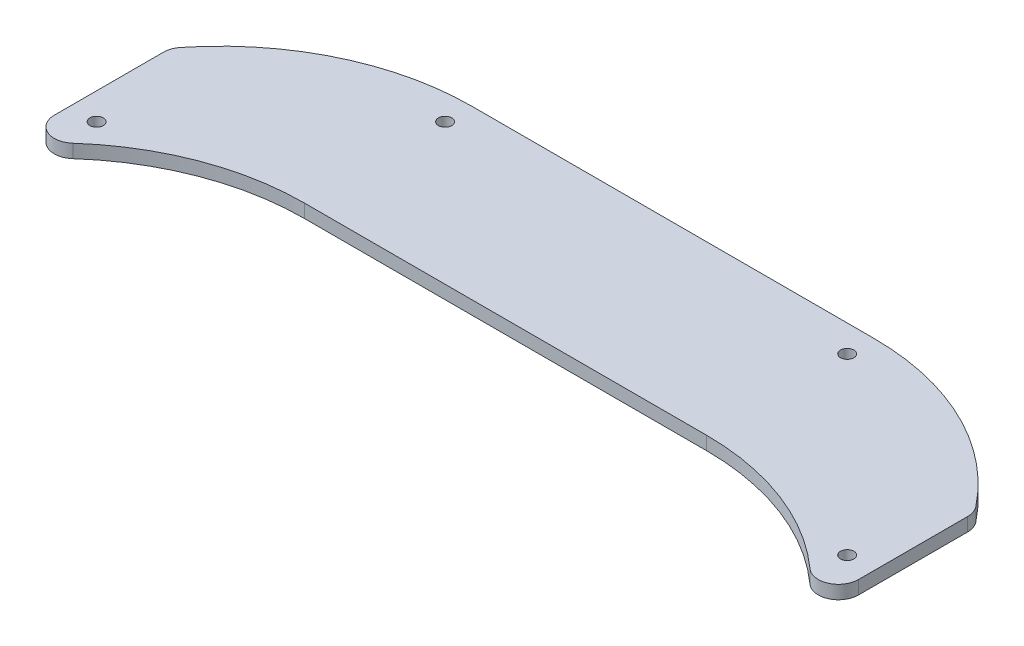
from build123d import *

# Parameters (mm, degrees)
BOSS_EXTRUDE1_DEPTH = 2
SKETCH2_R           = 1
CUT_EXTRUDE1_DEPTH  = 3
FILLET2_R           = 3


with BuildPart() as part:
    # Sketch1 → Boss-Extrude1 (new body)
    with BuildSketch(Plane(origin=(0, 0, 0), x_dir=(1, 0, 0), z_dir=(0, 1, 0))):
        with BuildLine():
            Line((-30, 40), (30, 40))
            ThreePointArc((30, 40), (46.770509831, 36.041019662), (60, 25))
            Line((60, 25), (60, 0))
            ThreePointArc((60, 0), (46.770509831, 11.041019662), (30, 15))
            Line((30, 15), (-30, 15))
            ThreePointArc((-30, 15), (-46.770509831, 11.041019662), (-60, 0))
            Line((-60, 0), (-60, 25))
            ThreePointArc((-60, 25), (-46.770509831, 36.041019662), (-30, 40))
        make_face()
    extrude(amount=BOSS_EXTRUDE1_DEPTH)

    # Sketch2 → Cut-Extrude1 (cut)
    with BuildSketch(Plane(origin=(0, 2, 0), x_dir=(1, 0, 0), z_dir=(0, 1, 0))):
        with Locations(Location((56, 10, 0), (0, 0, 270))):
            Circle(SKETCH2_R)
        with Locations(Location((30, 36, 0), (0, 0, 270))):
            Circle(SKETCH2_R)
        with Locations(Location((-56, 10, 0), (0, 0, 90))):
            Circle(SKETCH2_R)
        with Locations(Location((-30, 36, 0), (0, 0, 90))):
            Circle(SKETCH2_R)
    extrude(amount=-CUT_EXTRUDE1_DEPTH, mode=Mode.SUBTRACT)

    # Fillet2
    fillet2_edges = [part.edges().sort_by_distance(p)[0] for p in [
        (-60, 1, 0),
        (-60, 1, -25),
        (60, 1, -25),
        (60, 1, 0),
    ]]
    fillet(fillet2_edges, radius=FILLET2_R)


solid = part.part
